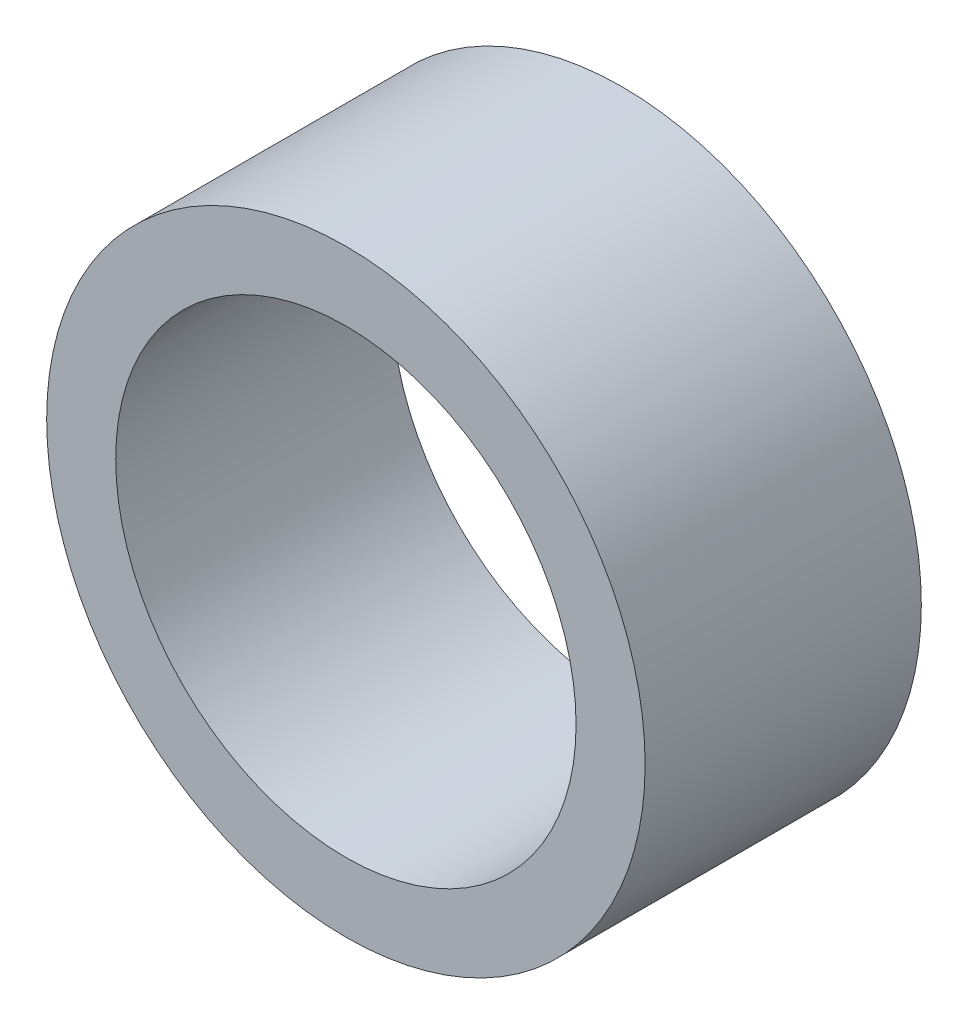
from build123d import *

# Parameters (mm, degrees)
SKETCH1_R           = 6.5
SKETCH1_R_2         = 5
BOSS_EXTRUDE1_DEPTH = 6


with BuildPart() as part:
    # Sketch1 → Boss-Extrude1 (new body)
    with BuildSketch(Plane.XY):
        Circle(SKETCH1_R)
        Circle(SKETCH1_R_2, mode=Mode.SUBTRACT)
    extrude(amount=BOSS_EXTRUDE1_DEPTH)


solid = part.part
